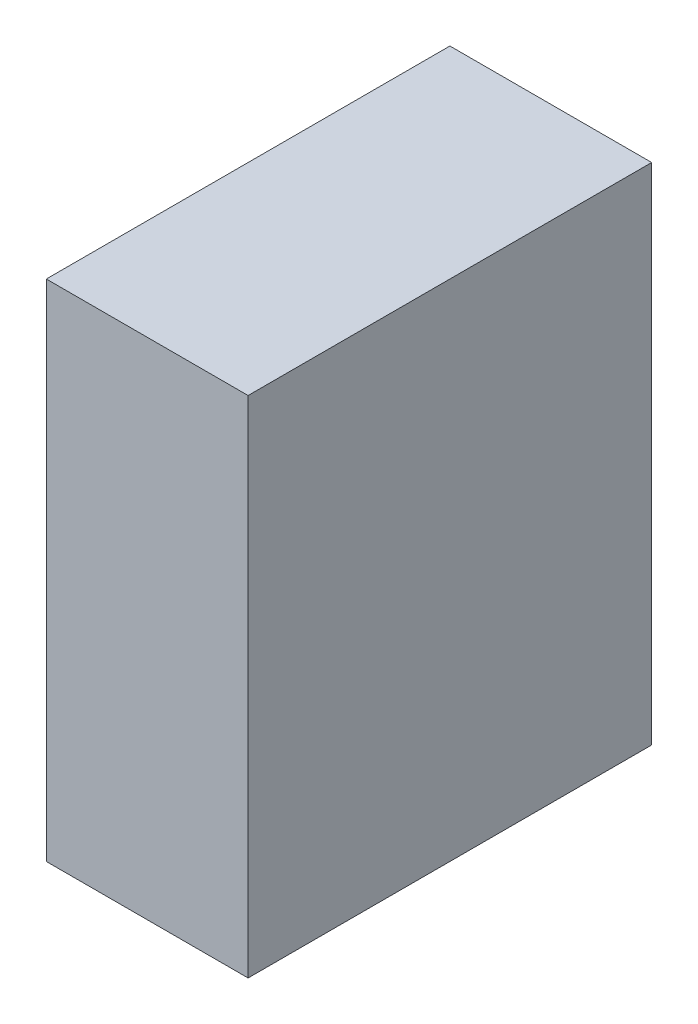
from build123d import *

# Parameters (mm, degrees)
SKETCH1_W           = 40
SKETCH1_H           = 80
BOSS_EXTRUDE1_DEPTH = 100
SKETCH3_R           = 10
SKETCH3_R_2         = 5
CUT_EXTRUDE2_DEPTH  = 20


with BuildPart() as part:
    # Sketch1 → Boss-Extrude1 (new body)
    with BuildSketch(Plane(origin=(0, 0, 0), x_dir=(1, 0, 0), z_dir=(0, 1, 0))):
        Rectangle(SKETCH1_W, SKETCH1_H)
    extrude(amount=BOSS_EXTRUDE1_DEPTH)

    # Sketch3 → Cut-Extrude2 (cut)
    with BuildSketch(Plane.XZ):
        with Locations(Location((0, 0, 0), (0, 0, 270))):
            Circle(SKETCH3_R)
        with Locations(Location((0, 22, 0), (0, 0, 270))):
            Circle(SKETCH3_R_2)
        with Locations(Location((0, -22, 0), (0, 0, 270))):
            Circle(SKETCH3_R_2)
    extrude(amount=-CUT_EXTRUDE2_DEPTH, mode=Mode.SUBTRACT)


solid = part.part
